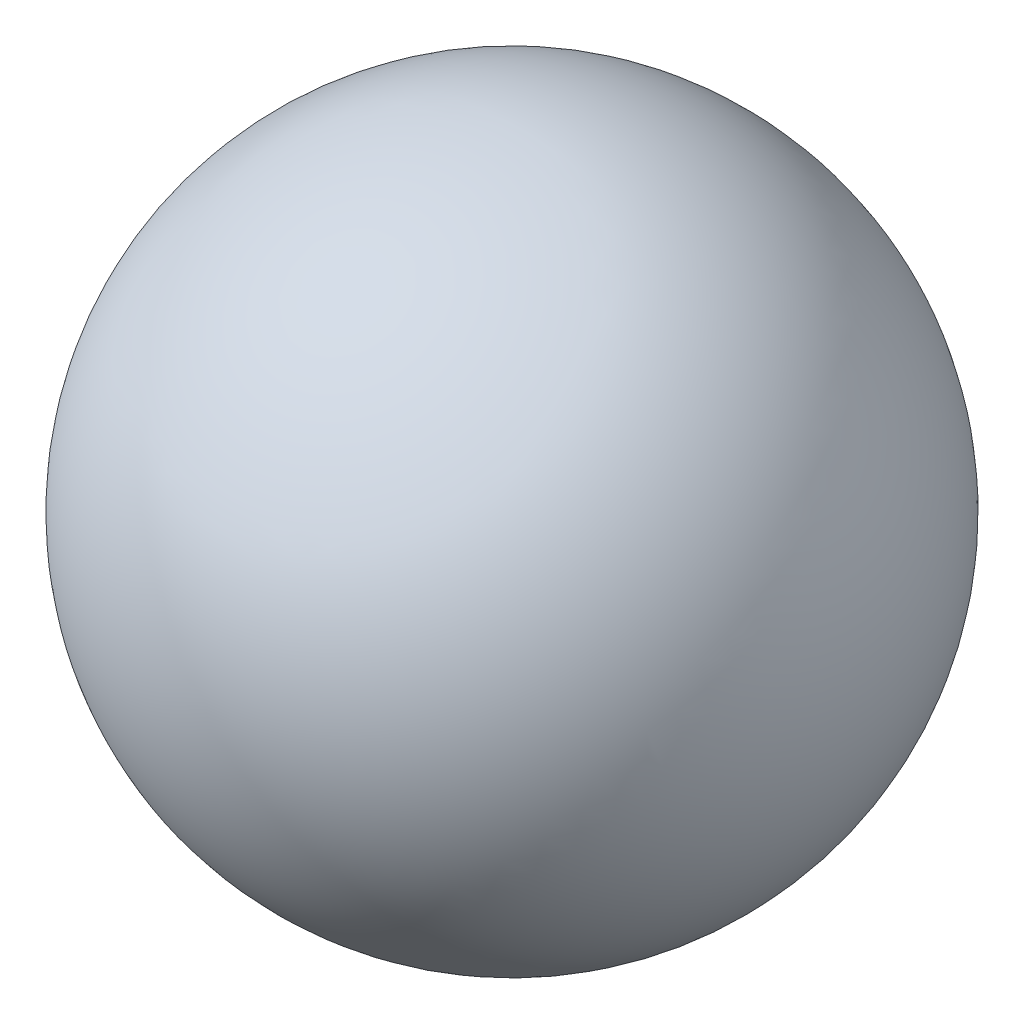
from build123d import *

# Parameters (mm, degrees)
SKETCH_2_R          = 2.5
CUT_EXTRUDE_1_DEPTH = 18.320508076
SKETCH_3_R          = 2.5
CUT_EXTRUDE_2_DEPTH = 18.320508076
SKETCH_4_R          = 2.5
CUT_EXTRUDE_3_DEPTH = 18.320508076


with BuildPart() as part:
    # 草图1 → 旋转1 (revolve)
    with BuildSketch(Plane(origin=(0, 0, 0), x_dir=(1, 0, 0), z_dir=(0, 1, 0))):
        with BuildLine():
            Line((0, 10), (0, -10))
            ThreePointArc((0, -10), (10, 0), (0, 10))
        make_face()
    revolve(axis=Axis((0, 0, -16.747658197), (0, 0, 1)))

    # 草图2 → 切除-拉伸1 (cut, through all)
    with BuildSketch(Plane(origin=(0, 0, 0), x_dir=(1, 0, 0), z_dir=(0, 1, 0))):
        with Locations(Location((0, 0, 0), (0, 0, 270))):
            Circle(SKETCH_2_R)
    extrude(amount=-CUT_EXTRUDE_1_DEPTH, mode=Mode.SUBTRACT)

    # 草图3 → 切除-拉伸2 (cut, through all)
    with BuildSketch(Plane(origin=(0, 0, 0), x_dir=(0, 0, -1), z_dir=(1, 0, 0))):
        Circle(SKETCH_3_R)
    extrude(amount=-CUT_EXTRUDE_2_DEPTH, mode=Mode.SUBTRACT)

    # 草图4 → 切除-拉伸3 (cut, through all)
    with BuildSketch(Plane.XY):
        Circle(SKETCH_4_R)
    extrude(amount=-CUT_EXTRUDE_3_DEPTH, mode=Mode.SUBTRACT)


solid = part.part
